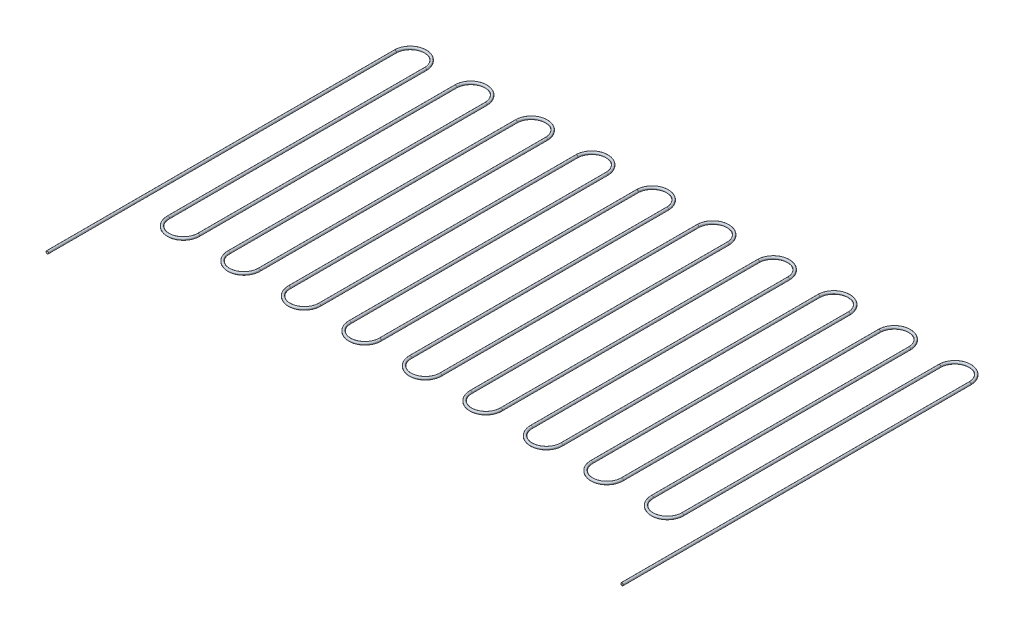
from build123d import *

# Parameters (mm, degrees)
SWEEP_THIN1_PROFILE_R   = 4.25
SWEEP_THIN1_PROFILE_R_2 = 3.9


with BuildPart() as part:
    # Sweep-Thin1: sweep along a path in Sketch4
    with BuildLine(Plane(origin=(0, 0, 0), x_dir=(1, 0, 0), z_dir=(0, 1, 0))) as sweep_thin1_path:
        Line((-950, -725), (-950, -425))
        Line((-950, -425), (-950, 425))
        ThreePointArc((-950, 425), (-900, 475), (-850, 425))
        Line((-850, 425), (-850, -425))
        ThreePointArc((-850, -425), (-800, -475), (-750, -425))
        Line((-750, -425), (-750, 425))
        ThreePointArc((-750, 425), (-700, 475), (-650, 425))
        Line((-650, 425), (-650, -425))
        ThreePointArc((-650, -425), (-600, -475), (-550, -425))
        Line((-550, -425), (-550, 425))
        ThreePointArc((-550, 425), (-500, 475), (-450, 425))
        Line((-450, 425), (-450, -425))
        ThreePointArc((-450, -425), (-400, -475), (-350, -425))
        Line((-350, -425), (-350, 425))
        ThreePointArc((-350, 425), (-300, 475), (-250, 425))
        Line((-250, 425), (-250, -425))
        ThreePointArc((-250, -425), (-200, -475), (-150, -425))
        Line((-150, -425), (-150, 425))
        ThreePointArc((-150, 425), (-100, 475), (-50, 425))
        Line((-50, 425), (-50, -425))
        ThreePointArc((-50, -425), (0, -475), (50, -425))
        Line((50, -425), (50, 425))
        ThreePointArc((50, 425), (100, 475), (150, 425))
        Line((150, 425), (150, -425))
        ThreePointArc((150, -425), (200, -475), (250, -425))
        Line((250, -425), (250, 425))
        ThreePointArc((250, 425), (300, 475), (350, 425))
        Line((350, 425), (350, -425))
        ThreePointArc((350, -425), (400, -475), (450, -425))
        Line((450, -425), (450, 425))
        ThreePointArc((450, 425), (500, 475), (550, 425))
        Line((550, 425), (550, -425))
        ThreePointArc((550, -425), (600, -475), (650, -425))
        Line((650, -425), (650, 425))
        ThreePointArc((650, 425), (700, 475), (750, 425))
        Line((750, 425), (750, -425))
        ThreePointArc((750, -425), (800, -475), (850, -425))
        Line((850, -425), (850, 425))
        ThreePointArc((850, 425), (900, 475), (950, 425))
        Line((950, 425), (950, -425))
        Line((950, -425), (950, -725))
    # Sweep-Thin1 profile (on start of the path) → Sweep-Thin1 (sweep)
    with BuildSketch(Plane(origin=(-950, 0, 725), x_dir=(-1, 0, 0), z_dir=(0, 0, -1))):
        Circle(SWEEP_THIN1_PROFILE_R)
        Circle(SWEEP_THIN1_PROFILE_R_2, mode=Mode.SUBTRACT)
    sweep(path=sweep_thin1_path.line)


solid = part.part
